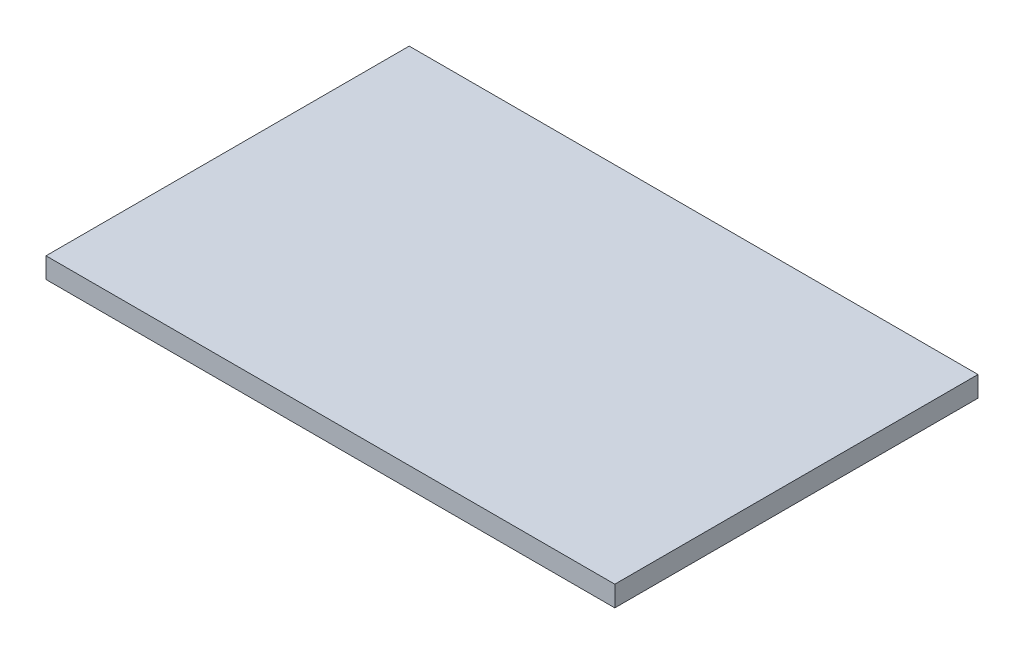
from build123d import *

# Parameters (mm, degrees)
SKETCH1_W           = 83
SKETCH1_H           = 53
BOSS_EXTRUDE1_DEPTH = 3


with BuildPart() as part:
    # Sketch1 → Boss-Extrude1 (new body)
    with BuildSketch(Plane(origin=(0, 0, 0), x_dir=(1, 0, 0), z_dir=(0, 1, 0))):
        Rectangle(SKETCH1_W, SKETCH1_H)
    extrude(amount=BOSS_EXTRUDE1_DEPTH)


solid = part.part
